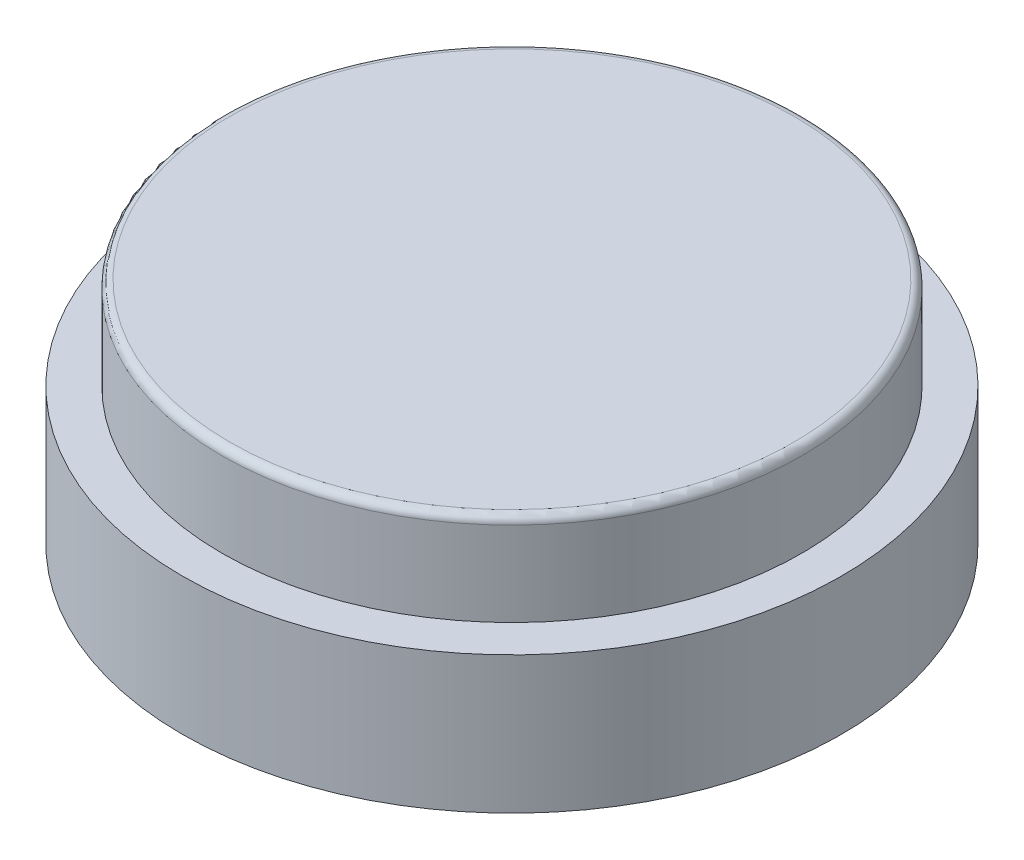
from build123d import *

# Parameters (mm, degrees)
SKETCH1_R           = 12.5
BOSS_EXTRUDE1_DEPTH = 5.2
SKETCH4_R           = 11
BOSS_EXTRUDE4_DEPTH = 3.5
FILLET1_R           = 0.3


with BuildPart() as part:
    # Sketch1 → Boss-Extrude1 (new body)
    with BuildSketch(Plane(origin=(0, 0, 0), x_dir=(1, 0, 0), z_dir=(0, 1, 0))):
        with Locations(Location((0, 0, 0), (0, 0, 270))):
            Circle(SKETCH1_R)
    extrude(amount=BOSS_EXTRUDE1_DEPTH)

    # Sketch4 → Boss-Extrude4 (add)
    with BuildSketch(Plane(origin=(0, 5.2, 0), x_dir=(1, 0, 0), z_dir=(0, 1, 0))):
        with Locations(Location((0, 0, 0), (0, 0, 270))):
            Circle(SKETCH4_R)
    extrude(amount=BOSS_EXTRUDE4_DEPTH)

    # Fillet1
    fillet1_edges = [part.edges().sort_by_distance(p)[0] for p in [
        (0, 8.7, -11),
    ]]
    fillet(fillet1_edges, radius=FILLET1_R)


solid = part.part
